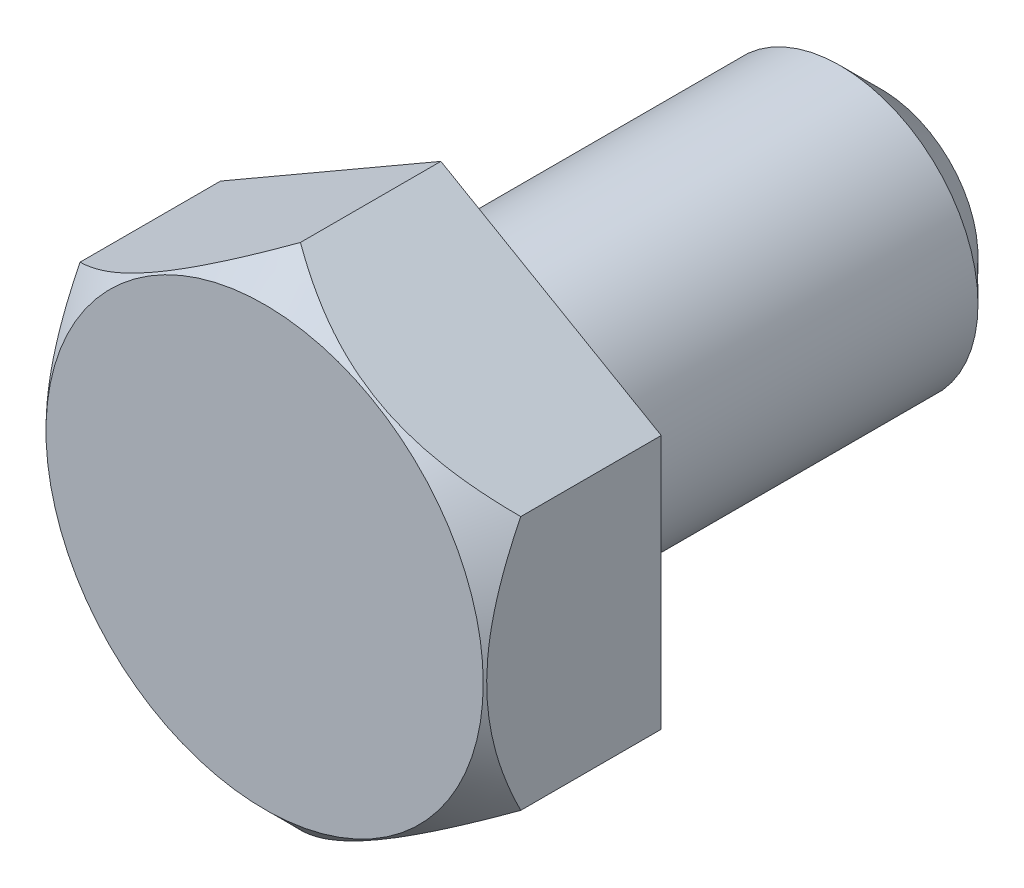
from build123d import *

# Parameters (mm, degrees)
EXTRUDE_1_DEPTH = 6.4
SKETCH_2_R      = 5
EXTRUDE_2_DEPTH = 16
CHAMFER_1_SIZE  = 1.5


with BuildPart() as part:
    # Эскиз1 → Вытянуть1 (new body)
    with BuildSketch(Plane.XY):
        Polygon((0, 9.237604307), (-8, 4.618802154), (-8, -4.618802154), (0, -9.237604307), (8, -4.618802154), (8, 4.618802154), align=None)
    extrude(amount=EXTRUDE_1_DEPTH)

    # Эскиз2 → Вытянуть2 (add)
    with BuildSketch(Plane(origin=(0, 0, 0), x_dir=(-1, 0, 0), z_dir=(0, 0, -1))):
        with Locations(Location((0, 0, 0), (0, 0, 180))):
            Circle(SKETCH_2_R)
    extrude(amount=EXTRUDE_2_DEPTH)

    # Эскиз15 → Вырез-Повернуть1 (revolve, cut)
    with BuildSketch(Plane(origin=(0, 0, 0), x_dir=(0, 0, -1), z_dir=(1, 0, 0)), mode=Mode.PRIVATE) as cut_revolve_1_sk:
        Polygon((-6.4, 9.237604307), (-6.4, 7.937604307), (-5.1, 9.237604307), align=None)
    revolve(cut_revolve_1_sk.sketch.rotate(Axis((0, 0, -3.534703431), (0, 0, -1)), 300.00000006), axis=Axis((0, 0, -3.534703431), (0, 0, -1)), mode=Mode.SUBTRACT)

    # Фаска1
    chamfer_1_edges = [part.edges().sort_by_distance(p)[0] for p in [
        (-5, 0, -16),
    ]]
    chamfer(chamfer_1_edges, length=CHAMFER_1_SIZE)


solid = part.part
